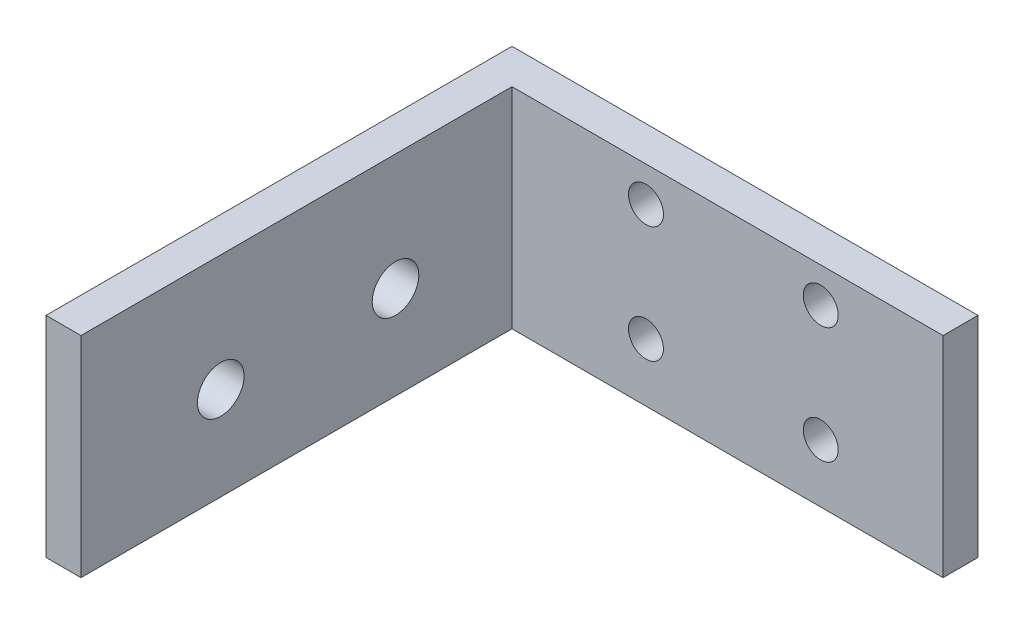
from build123d import *

# Parameters (mm, degrees)
ESQUISSE1_W             = 40
ESQUISSE1_H             = 18
BOSS_EXTRU_1_DEPTH      = 3
ESQUISSE2_W             = 3
ESQUISSE2_H             = 18
BOSS_EXTRU_2_DEPTH      = 37
ESQUISSE3_R             = 1.5
ENL_V_MAT_EXTRU_1_DEPTH = 58.384666942
ESQUISSE4_R             = 2
ENL_V_MAT_EXTRU_2_DEPTH = 58.384666942


with BuildPart() as part:
    # Esquisse1 → Boss.-Extru.1 (new body)
    with BuildSketch(Plane.XY):
        with Locations((20, 9)):
            Rectangle(ESQUISSE1_W, ESQUISSE1_H)
    extrude(amount=BOSS_EXTRU_1_DEPTH)

    # Esquisse2 → Boss.-Extru.2 (add)
    with BuildSketch(Plane.XY.offset(3)):
        with Locations((1.5, 9)):
            Rectangle(ESQUISSE2_W, ESQUISSE2_H)
    extrude(amount=BOSS_EXTRU_2_DEPTH)

    # Esquisse3 → Enlèv. mat.-Extru.1 (cut, through all)
    with BuildSketch(Plane.XY.offset(3)):
        with Locations((14.5, 15)):
            Circle(ESQUISSE3_R)
        with Locations((29.5, 15)):
            Circle(ESQUISSE3_R)
        with Locations((14.5, 5)):
            Circle(ESQUISSE3_R)
        with Locations((29.5, 5)):
            Circle(ESQUISSE3_R)
    extrude(amount=-ENL_V_MAT_EXTRU_1_DEPTH, mode=Mode.SUBTRACT)

    # Esquisse4 → Enlèv. mat.-Extru.2 (cut, through all)
    with BuildSketch(Plane(origin=(3, 0, 0), x_dir=(0, 0, -1), z_dir=(1, 0, 0))):
        with Locations(Location((-28, 8, 0), (0, 0, 90))):
            Circle(ESQUISSE4_R)
        with Locations(Location((-13, 8, 0), (0, 0, 90))):
            Circle(ESQUISSE4_R)
    extrude(amount=-ENL_V_MAT_EXTRU_2_DEPTH, mode=Mode.SUBTRACT)


solid = part.part
